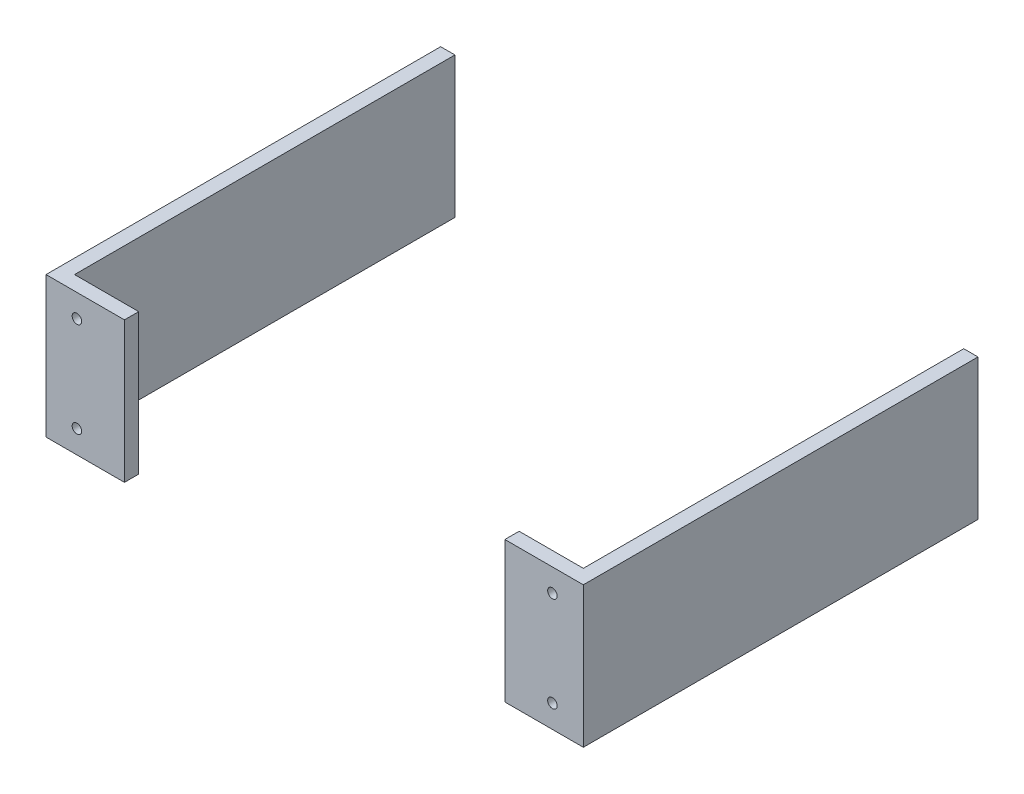
from build123d import *

# Parameters (mm, degrees)
SKETCH1_W           = 113
SKETCH1_H           = 30
BOSS_EXTRUDE1_DEPTH = 3
SKETCH2_W           = 3
SKETCH2_H           = 30
BOSS_EXTRUDE2_DEPTH = 80
SKETCH4_R           = 1
CUT_EXTRUDE1_DEPTH  = 10.5
SKETCH5_W           = 80
SKETCH5_H           = 30
CUT_EXTRUDE2_DEPTH  = 102.519702521
SKETCH6_W           = 125.18671139
SKETCH6_H           = 167.471966336
CUT_EXTRUDE3_DEPTH  = 0.2
SKETCH7_W           = 137.201217616
SKETCH7_H           = 176.824652728
CUT_EXTRUDE4_DEPTH  = 0.2


with BuildPart() as part:
    # Sketch1 → Boss-Extrude1 (new body)
    with BuildSketch(Plane.XY):
        Rectangle(SKETCH1_W, SKETCH1_H)
    extrude(amount=BOSS_EXTRUDE1_DEPTH)

    # Sketch2 → Boss-Extrude2 (add)
    with BuildSketch(Plane(origin=(0, 0, 0), x_dir=(-1, 0, 0), z_dir=(0, 0, -1))):
        with Locations((-55, 0)):
            Rectangle(SKETCH2_W, SKETCH2_H)
        with Locations((55, 0)):
            Rectangle(SKETCH2_W, SKETCH2_H)
    extrude(amount=BOSS_EXTRUDE2_DEPTH)

    # Sketch4 → Cut-Extrude1 (cut)
    with BuildSketch(Plane.XY.offset(3)):
        with Locations((-50, 10)):
            Circle(SKETCH4_R)
        with Locations((50, 10)):
            Circle(SKETCH4_R)
        with Locations((50, -10)):
            Circle(SKETCH4_R)
        with Locations((-50, -10)):
            Circle(SKETCH4_R)
    extrude(amount=-CUT_EXTRUDE1_DEPTH, mode=Mode.SUBTRACT)

    # Sketch5 → Cut-Extrude2 (cut, through all)
    with BuildSketch(Plane.XY.offset(3)):
        Rectangle(SKETCH5_W, SKETCH5_H)
    extrude(amount=-CUT_EXTRUDE2_DEPTH, mode=Mode.SUBTRACT)


with BuildPart() as cut_extrude2_piece_1:
    # of the separate pieces the step leaves, piece 1, a body of its own (cut_extrude2_pieces)
    add(part.part.solids().sort_by_distance((56.5, -15, -80))[0])


with BuildPart() as cut_extrude2_piece_2:
    # of the separate pieces the step leaves, piece 2, a body of its own (cut_extrude2_pieces)
    add(part.part.solids().sort_by_distance((-40, -15, 3))[0])


with BuildPart() as cut_extrude3_tool:
    # Sketch6 → Cut-Extrude3 (new body)
    with BuildSketch(Plane(origin=(0, 15, 0), x_dir=(1, 0, 0), z_dir=(0, 1, 0))):
        Rectangle(SKETCH6_W, SKETCH6_H)
    extrude(amount=-CUT_EXTRUDE3_DEPTH)


with BuildPart() as cut_extrude2_piece_1_1:
    add(cut_extrude2_piece_1.part)

    # Cut-Extrude3: cut by cut_extrude3_tool
    add(cut_extrude3_tool.part, mode=Mode.SUBTRACT)


with BuildPart() as cut_extrude2_piece_2_1:
    add(cut_extrude2_piece_2.part)

    # Cut-Extrude3: cut by cut_extrude3_tool
    add(cut_extrude3_tool.part, mode=Mode.SUBTRACT)


with BuildPart() as cut_extrude4_tool:
    # Sketch7 → Cut-Extrude4 (new body)
    with BuildSketch(Plane.XZ.offset(15)):
        Rectangle(SKETCH7_W, SKETCH7_H)
    extrude(amount=-CUT_EXTRUDE4_DEPTH)


with BuildPart() as cut_extrude2_piece_1_2:
    add(cut_extrude2_piece_1_1.part)

    # Cut-Extrude4: cut by cut_extrude4_tool
    add(cut_extrude4_tool.part, mode=Mode.SUBTRACT)


with BuildPart() as cut_extrude2_piece_2_2:
    add(cut_extrude2_piece_2_1.part)

    # Cut-Extrude4: cut by cut_extrude4_tool
    add(cut_extrude4_tool.part, mode=Mode.SUBTRACT)


solid = Compound([cut_extrude2_piece_1_2.part, cut_extrude2_piece_2_2.part])
